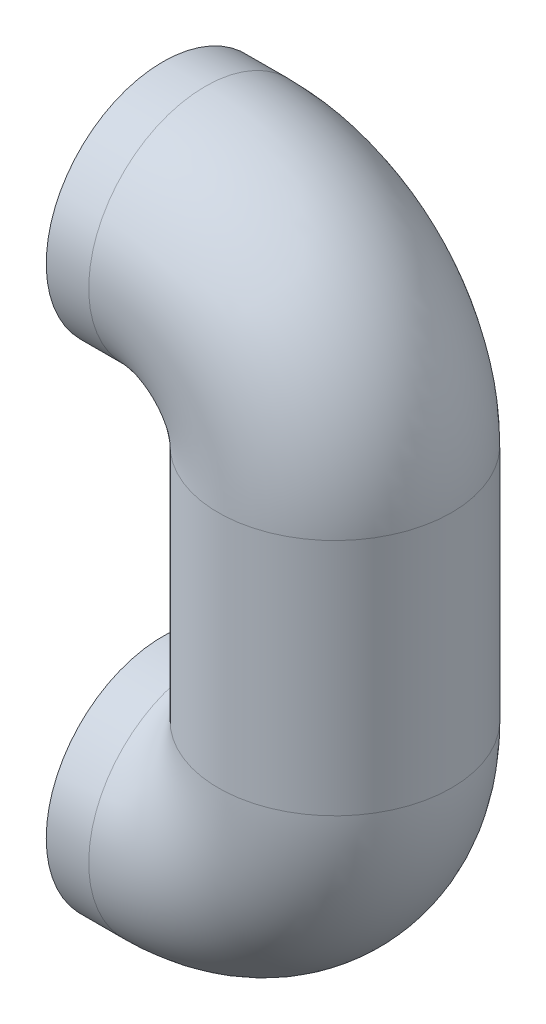
from build123d import *

# Parameters (mm, degrees)
SKETCH2_R = 22.5


with BuildPart() as part:
    # Sweep1: sweep along a path in Sketch1
    with BuildLine(Plane.XY) as sweep1_path:
        Line((0, 0), (8.2, 0))
        ThreePointArc((8.2, 0), (25.87766953, 7.32233047), (33.2, 25))
        Line((33.2, 25), (33.2, 71))
        ThreePointArc((33.2, 71), (25.87766953, 88.67766953), (8.2, 96))
        Line((8.2, 96), (0, 96))
    # Sketch2 → Sweep1 (sweep)
    with BuildSketch(Plane(origin=(0, 0, 0), x_dir=(0, 0, -1), z_dir=(1, 0, 0))):
        Circle(SKETCH2_R)
    sweep(path=sweep1_path.line)


solid = part.part
